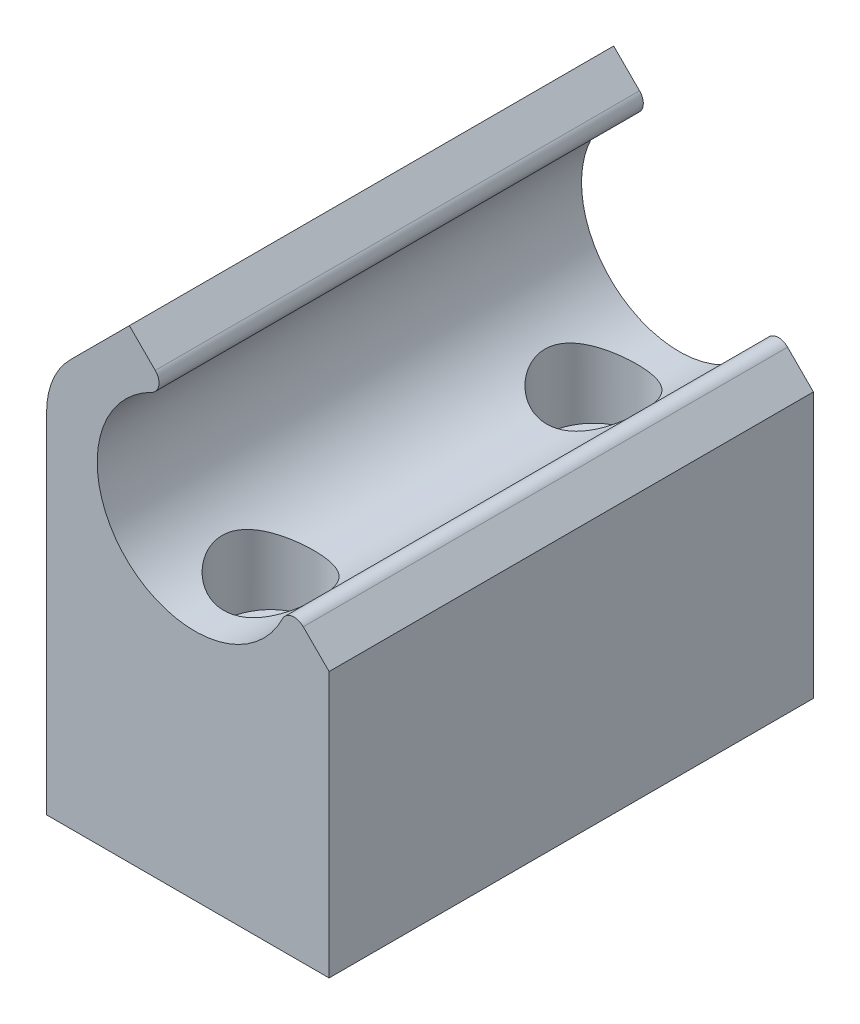
from build123d import *

# Parameters (mm, degrees)
BOSS_EXTRUDE1_DEPTH = 30
FILLET1_R           = 0.8
SKETCH3_R           = 3
CUT_EXTRUDE1_DEPTH  = 7
SKETCH4_R           = 1.55
CUT_EXTRUDE2_DEPTH  = 40.0397494
FILLET2_R           = 5


with BuildPart() as part:
    # Sketch1 → Boss-Extrude1 (new body)
    with BuildSketch(Plane.XY):
        with BuildLine():
            Line((0, 0), (17.5, 0))
            Line((17.5, 0), (17.5, 16.44))
            Line((17.5, 16.44), (15.025126266, 18.914873734))
            ThreePointArc((15.025126266, 18.914873734), (4.907782078, 16.219443047), (7.603212766, 26.336787234))
            Line((7.603212766, 26.336787234), (5.128339032, 28.811660968))
            Line((5.128339032, 28.811660968), (0, 23.683321936))
            Line((0, 23.683321936), (0, 0))
        make_face()
    extrude(amount=BOSS_EXTRUDE1_DEPTH)

    # Fillet1
    fillet1_edges = [part.edges().sort_by_distance(p)[0] for p in [
        (7.603212766, 26.336787234, 15),
        (15.025126266, 18.914873734, 15),
    ]]
    fillet(fillet1_edges, radius=FILLET1_R)

    # Sketch3 → Cut-Extrude1 (cut)
    with BuildSketch(Plane(origin=(0, 17.828405067, 0), x_dir=(-1, 0, 0), z_dir=(0, -1, 0))):
        with Locations(Location((-8.875495285, -5, 0), (0, 0, 270))):
            Circle(SKETCH3_R)
        with Locations(Location((-8.875495285, -25, 0), (0, 0, 270))):
            Circle(SKETCH3_R)
    extrude(amount=CUT_EXTRUDE1_DEPTH, mode=Mode.SUBTRACT)

    # Sketch4 → Cut-Extrude2 (cut, through all)
    with BuildSketch(Plane(origin=(0, 17.828405067, 0), x_dir=(-1, 0, 0), z_dir=(0, -1, 0))):
        with Locations(Location((-8.875495285, -5, 0), (0, 0, 90))):
            Circle(SKETCH4_R)
        with Locations(Location((-8.875495285, -25, 0), (0, 0, 90))):
            Circle(SKETCH4_R)
    extrude(amount=CUT_EXTRUDE2_DEPTH, mode=Mode.SUBTRACT)

    # Fillet2
    fillet2_edges = [part.edges().sort_by_distance(p)[0] for p in [
        (0, 23.683321936, 15),
    ]]
    fillet(fillet2_edges, radius=FILLET2_R)


solid = part.part
